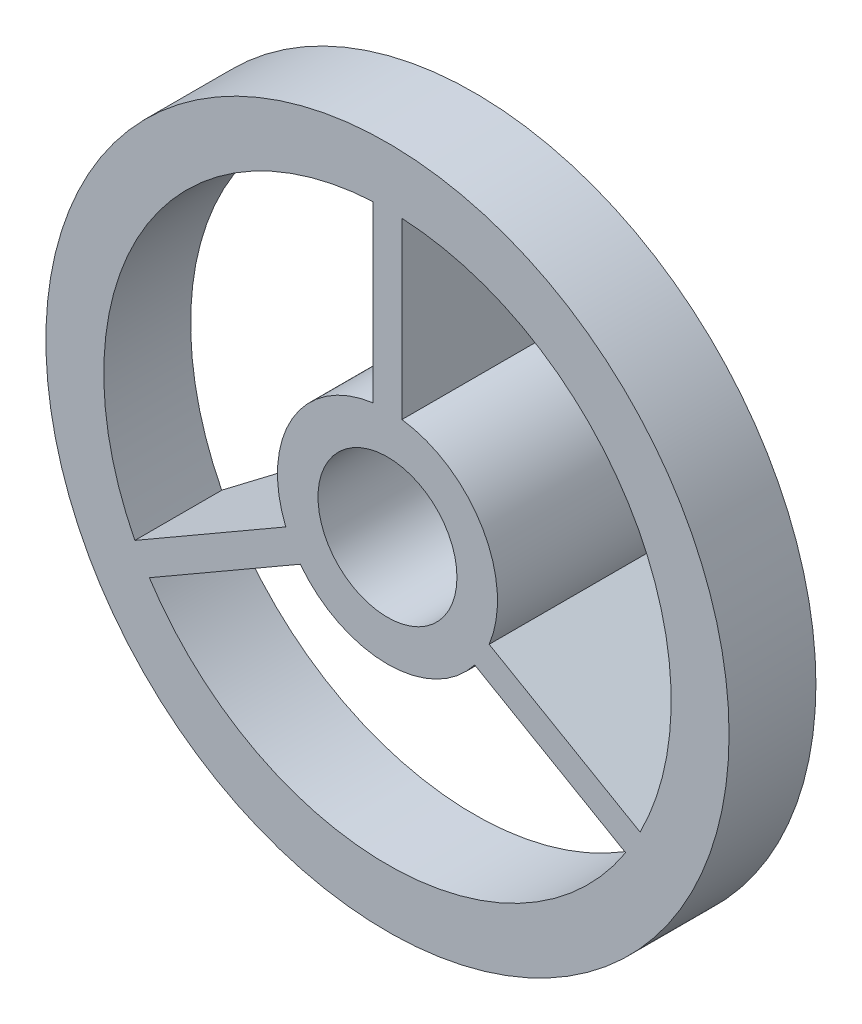
from build123d import *

# Parameters (mm, degrees)
SKETCH2_R           = 1.9
SKETCH2_R_2         = 1.2
BOSS_EXTRUDE1_DEPTH = 3.5
SKETCH3_R           = 5.9
SKETCH3_R_2         = 4.9
BOSS_EXTRUDE2_DEPTH = 1.5
BOSS_EXTRUDE3_DEPTH = 0.25
CIRPATTERN1_COUNT   = 3


with BuildPart() as part:
    # Sketch2 → Boss-Extrude1 (new body)
    with BuildSketch(Plane.XY):
        Circle(SKETCH2_R)
        Circle(SKETCH2_R_2, mode=Mode.SUBTRACT)
    extrude(amount=BOSS_EXTRUDE1_DEPTH)



with BuildPart() as body_2:
    # Sketch3 → Boss-Extrude2 (new body)
    with BuildSketch(Plane.XY.offset(3.5)):
        Circle(SKETCH3_R)
        Circle(SKETCH3_R_2, mode=Mode.SUBTRACT)
    extrude(amount=-BOSS_EXTRUDE2_DEPTH)


with BuildPart() as part_1:
    add(part.part)

    add(body_2.part)  # Boss-Extrude3 merges body 2
    # Sketch4 → Boss-Extrude3 (add, symmetric)
    with BuildSketch(Plane(origin=(0, 0, 0), x_dir=(0, 0, -1), z_dir=(1, 0, 0))):
        Polygon((0, 1.9), (-2, 4.9), (-3.5, 4.9), (-3.5, 1.9), (-3.5, 1.7), (0, 1.7), align=None)
    boss_extrude3 = extrude(amount=BOSS_EXTRUDE3_DEPTH, both=True)

    # CirPattern1: Boss-Extrude3 ×3 about axis
    cirpattern1_axis = Axis((0, 0, 0), (0, 0, 1))
    for i in range(1, CIRPATTERN1_COUNT):
        add(boss_extrude3.rotate(cirpattern1_axis, i * 360 / CIRPATTERN1_COUNT))


solid = part_1.part
